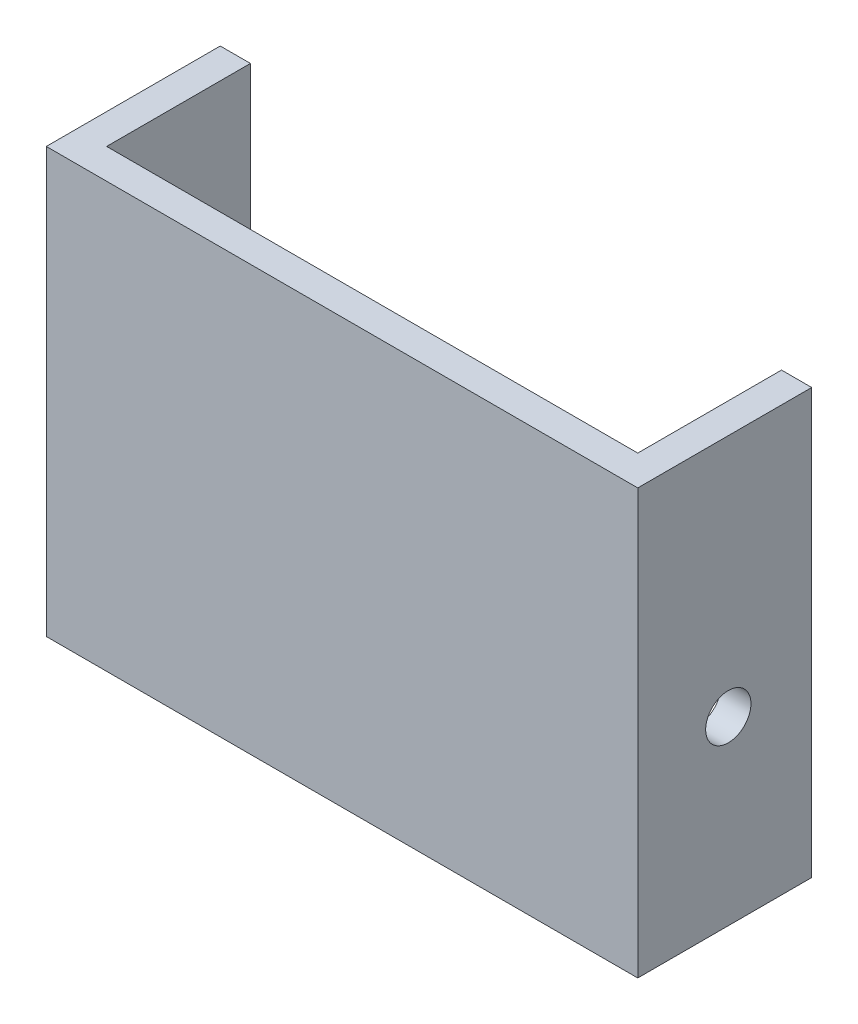
from build123d import *

# Parameters (mm, degrees)
SKETCH1_W           = 35.2
SKETCH1_H           = 28.13
BOSS_EXTRUDE1_DEPTH = 2
SKETCH2_W           = 11.528235963
SKETCH2_H           = 28.13
BOSS_EXTRUDE2_DEPTH = 2
SKETCH3_W           = 11.528235963
SKETCH3_H           = 28.13
BOSS_EXTRUDE3_DEPTH = 2
SKETCH4_R           = 1.5
CUT_EXTRUDE1_DEPTH  = 43.722962275


with BuildPart() as part:
    # Sketch1 → Boss-Extrude1 (new body)
    with BuildSketch(Plane.XY):
        Rectangle(SKETCH1_W, SKETCH1_H)
    extrude(amount=BOSS_EXTRUDE1_DEPTH)

    # Sketch2 → Boss-Extrude2 (add)
    with BuildSketch(Plane(origin=(17.6, 0, 0), x_dir=(0, 0, -1), z_dir=(1, 0, 0))):
        with Locations((3.764117982, 0)):
            Rectangle(SKETCH2_W, SKETCH2_H)
    extrude(amount=BOSS_EXTRUDE2_DEPTH)

    # Sketch3 → Boss-Extrude3 (add)
    with BuildSketch(Plane.ZY.offset(17.6)):
        with Locations((-3.764117982, 0)):
            Rectangle(SKETCH3_W, SKETCH3_H)
    extrude(amount=BOSS_EXTRUDE3_DEPTH)

    # Sketch4 → Cut-Extrude1 (cut, through all)
    with BuildSketch(Plane(origin=(19.6, 0, 0), x_dir=(0, 0, -1), z_dir=(1, 0, 0))):
        with Locations((4, -2.065)):
            Circle(SKETCH4_R)
    extrude(amount=-CUT_EXTRUDE1_DEPTH, mode=Mode.SUBTRACT)


solid = part.part
